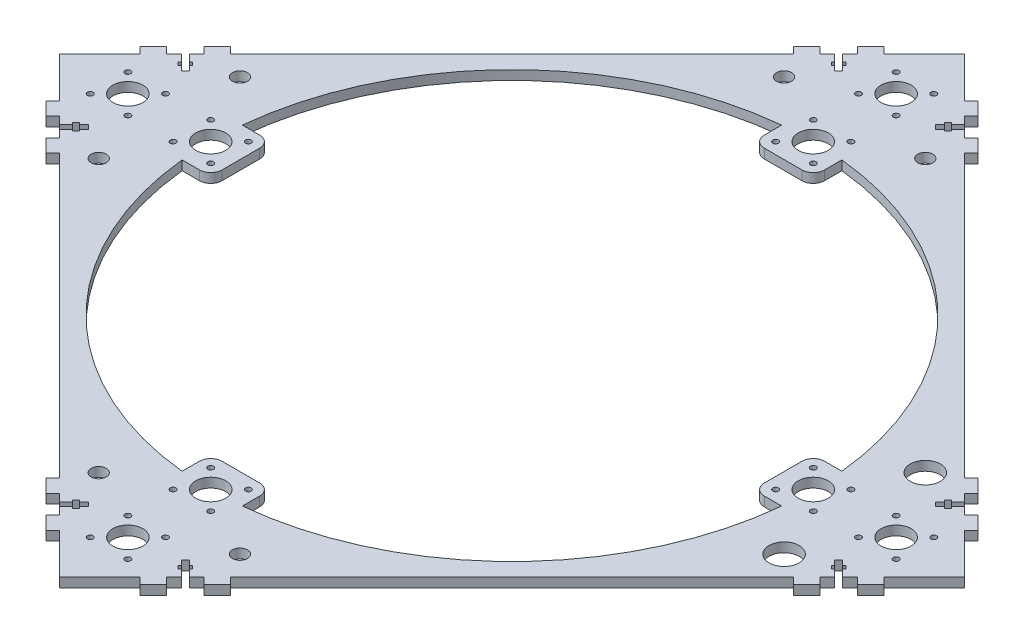
from build123d import *

# Parameters (mm, degrees)
SKETCH1_TOP_SKETCH_7_R   = 8
SKETCH1_TOP_SKETCH_7_R_2 = 1.5
SKETCH1_TOP_SKETCH_7_R_3 = 4
BOSS_EXTRUDE2_DEPTH      = 5


with BuildPart() as part:
    # Sketch1-Top Sketch<7> → Boss-Extrude2 (new body)
    with BuildSketch(Plane(origin=(0, 0, 0), x_dir=(1, 0, 0), z_dir=(0, 1, 0))):
        Polygon((32.022907321, 215.464466094), (24.951839509, 222.535533906), (21.416305603, 219), (0, 240.416305603), (-21.416305603, 219), (-24.951839509, 222.535533906), (-32.022907321, 215.464466094), (-28.487373415, 211.928932188), (-32.39749263, 208.018812973), (-28.861958724, 204.483279068), (-27.978075248, 205.367162544), (-26.210308295, 203.599395591), (-27.094191771, 202.715512115), (-24.619318037, 200.24063838), (-26.74063838, 198.119318037), (-29.215512115, 200.594191771), (-30.099395591, 199.710308295), (-31.867162544, 201.478075248), (-30.983279068, 202.361958724), (-34.518812973, 205.89749263), (-38.428932188, 201.987373415), (-41.964466094, 205.522907321), (-49.035533906, 198.451839509), (-45.5, 194.916305603), (-194.916305603, 45.5), (-198.451839509, 49.035533906), (-205.522907321, 41.964466094), (-201.987373415, 38.428932188), (-205.89749263, 34.518812973), (-202.361958724, 30.983279068), (-201.478075248, 31.867162544), (-199.710308295, 30.099395591), (-200.594191771, 29.215512115), (-198.119318037, 26.74063838), (-200.24063838, 24.619318037), (-202.715512115, 27.094191771), (-203.599395591, 26.210308295), (-205.367162544, 27.978075248), (-204.483279068, 28.861958724), (-208.018812973, 32.39749263), (-211.928932188, 28.487373415), (-215.464466094, 32.022907321), (-222.535533906, 24.951839509), (-219, 21.416305603), (-240.416305603, 0), (-219, -21.416305603), (-222.535533906, -24.951839509), (-215.464466094, -32.022907321), (-211.928932188, -28.487373415), (-208.018812973, -32.39749263), (-204.483279068, -28.861958724), (-205.367162544, -27.978075248), (-203.599395591, -26.210308295), (-202.715512115, -27.094191771), (-200.24063838, -24.619318037), (-198.119318037, -26.74063838), (-200.594191771, -29.215512115), (-199.710308295, -30.099395591), (-201.478075248, -31.867162544), (-202.361958724, -30.983279068), (-205.89749263, -34.518812973), (-201.987373415, -38.428932188), (-205.522907321, -41.964466094), (-198.451839509, -49.035533906), (-194.916305603, -45.5), (-45.5, -194.916305603), (-49.035533906, -198.451839509), (-41.964466094, -205.522907321), (-38.428932188, -201.987373415), (-34.518812973, -205.89749263), (-30.983279068, -202.361958724), (-31.867162544, -201.478075248), (-30.099395591, -199.710308295), (-29.215512115, -200.594191771), (-26.74063838, -198.119318037), (-24.619318037, -200.24063838), (-27.094191771, -202.715512115), (-26.210308295, -203.599395591), (-27.978075248, -205.367162544), (-28.861958724, -204.483279068), (-32.39749263, -208.018812973), (-28.487373415, -211.928932188), (-32.022907321, -215.464466094), (-24.951839509, -222.535533906), (-21.416305603, -219), (0, -240.416305603), (21.416305603, -219), (24.951839509, -222.535533906), (32.022907321, -215.464466094), (28.487373415, -211.928932188), (32.39749263, -208.018812973), (28.861958724, -204.483279068), (27.978075248, -205.367162544), (26.210308295, -203.599395591), (27.094191771, -202.715512115), (24.619318037, -200.24063838), (26.74063838, -198.119318037), (29.215512115, -200.594191771), (30.099395591, -199.710308295), (31.867162544, -201.478075248), (30.983279068, -202.361958724), (34.518812973, -205.89749263), (38.428932188, -201.987373415), (41.964466094, -205.522907321), (49.035533906, -198.451839509), (45.5, -194.916305603), (194.916305603, -45.5), (198.451839509, -49.035533906), (205.522907321, -41.964466094), (201.987373415, -38.428932188), (205.89749263, -34.518812973), (202.361958724, -30.983279068), (201.478075248, -31.867162544), (199.710308295, -30.099395591), (200.594191771, -29.215512115), (198.119318037, -26.74063838), (200.24063838, -24.619318037), (202.715512115, -27.094191771), (203.599395591, -26.210308295), (205.367162544, -27.978075248), (204.483279068, -28.861958724), (208.018812973, -32.39749263), (211.928932188, -28.487373415), (215.464466094, -32.022907321), (222.535533906, -24.951839509), (219, -21.416305603), (240.416305603, 0), (219, 21.416305603), (222.535533906, 24.951839509), (215.464466094, 32.022907321), (211.928932188, 28.487373415), (208.018812973, 32.39749263), (204.483279068, 28.861958724), (205.367162544, 27.978075248), (203.599395591, 26.210308295), (202.715512115, 27.094191771), (200.24063838, 24.619318037), (198.119318037, 26.74063838), (200.594191771, 29.215512115), (199.710308295, 30.099395591), (201.478075248, 31.867162544), (202.361958724, 30.983279068), (205.89749263, 34.518812973), (201.987373415, 38.428932188), (205.522907321, 41.964466094), (198.451839509, 49.035533906), (194.916305603, 45.5), (45.5, 194.916305603), (49.035533906, 198.451839509), (41.964466094, 205.522907321), (38.428932188, 201.987373415), (34.518812973, 205.89749263), (30.983279068, 202.361958724), (31.867162544, 201.478075248), (30.099395591, 199.710308295), (29.215512115, 200.594191771), (26.74063838, 198.119318037), (24.619318037, 200.24063838), (27.094191771, 202.715512115), (26.210308295, 203.599395591), (27.978075248, 205.367162544), (28.861958724, 204.483279068), (32.39749263, 208.018812973), (28.487373415, 211.928932188), align=None)
        with Locations(Location((182, -37.5, 0), (0, 0, 270))):
            Circle(SKETCH1_TOP_SKETCH_7_R, mode=Mode.SUBTRACT)
        with BuildLine():
            Line((16, -159.197989937), (16, -150))
            ThreePointArc((16, -150), (14.242640687, -145.757359313), (10, -144))
            Line((10, -144), (-10, -144))
            ThreePointArc((-10, -144), (-14.242640687, -145.757359313), (-16, -150))
            Line((-16, -150), (-16, -159.197989937))
            ThreePointArc((-16, -159.197989937), (-113.13708499, -113.13708499), (-159.197989937, -16))
            Line((-159.197989937, -16), (-150, -16))
            ThreePointArc((-150, -16), (-145.757359313, -14.242640687), (-144, -10))
            Line((-144, -10), (-144, 10))
            ThreePointArc((-144, 10), (-145.757359313, 14.242640687), (-150, 16))
            Line((-150, 16), (-159.197989937, 16))
            ThreePointArc((-159.197989937, 16), (-113.13708499, 113.13708499), (-16, 159.197989937))
            Line((-16, 159.197989937), (-16, 150))
            ThreePointArc((-16, 150), (-14.242640687, 145.757359313), (-10, 144))
            Line((-10, 144), (10, 144))
            ThreePointArc((10, 144), (14.242640687, 145.757359313), (16, 150))
            Line((16, 150), (16, 159.197989937))
            ThreePointArc((16, 159.197989937), (113.13708499, 113.13708499), (159.197989937, 16))
            Line((159.197989937, 16), (150, 16))
            ThreePointArc((150, 16), (145.757359313, 14.242640687), (144, 10))
            Line((144, 10), (144, -10))
            ThreePointArc((144, -10), (145.757359313, -14.242640687), (150, -16))
            Line((150, -16), (159.197989937, -16))
            ThreePointArc((159.197989937, -16), (113.13708499, -113.13708499), (16, -159.197989937))
        make_face(mode=Mode.SUBTRACT)
        with Locations(Location((160, 0, 0), (0, 0, 270))):
            Circle(SKETCH1_TOP_SKETCH_7_R, mode=Mode.SUBTRACT)
        with Locations(Location((182, 37.5, 0), (0, 0, 270))):
            Circle(SKETCH1_TOP_SKETCH_7_R, mode=Mode.SUBTRACT)
        with Locations(Location((10, 214, 0), (0, 0, 270))):
            Circle(SKETCH1_TOP_SKETCH_7_R_2, mode=Mode.SUBTRACT)
        with Locations(Location((-10, -214, 0), (0, 0, 270))):
            Circle(SKETCH1_TOP_SKETCH_7_R_2, mode=Mode.SUBTRACT)
        with Locations(Location((-10, -194, 0), (0, 0, 270))):
            Circle(SKETCH1_TOP_SKETCH_7_R_2, mode=Mode.SUBTRACT)
        with Locations(Location((-10, -170, 0), (0, 0, 270))):
            Circle(SKETCH1_TOP_SKETCH_7_R_2, mode=Mode.SUBTRACT)
        with Locations(Location((0, -160, 0), (0, 0, 270))):
            Circle(SKETCH1_TOP_SKETCH_7_R, mode=Mode.SUBTRACT)
        with Locations(Location((-10, -150, 0), (0, 0, 270))):
            Circle(SKETCH1_TOP_SKETCH_7_R_2, mode=Mode.SUBTRACT)
        with Locations(Location((-214, -10, 0), (0, 0, 270))):
            Circle(SKETCH1_TOP_SKETCH_7_R_2, mode=Mode.SUBTRACT)
        with Locations(Location((-194, -10, 0), (0, 0, 270))):
            Circle(SKETCH1_TOP_SKETCH_7_R_2, mode=Mode.SUBTRACT)
        with Locations(Location((-170, -10, 0), (0, 0, 270))):
            Circle(SKETCH1_TOP_SKETCH_7_R_2, mode=Mode.SUBTRACT)
        with Locations(Location((-150, -10, 0), (0, 0, 270))):
            Circle(SKETCH1_TOP_SKETCH_7_R_2, mode=Mode.SUBTRACT)
        with Locations(Location((10, -214, 0), (0, 0, 270))):
            Circle(SKETCH1_TOP_SKETCH_7_R_2, mode=Mode.SUBTRACT)
        with Locations(Location((0, -204, 0), (0, 0, 270))):
            Circle(SKETCH1_TOP_SKETCH_7_R, mode=Mode.SUBTRACT)
        with Locations(Location((10, -194, 0), (0, 0, 270))):
            Circle(SKETCH1_TOP_SKETCH_7_R_2, mode=Mode.SUBTRACT)
        with Locations(Location((10, -170, 0), (0, 0, 270))):
            Circle(SKETCH1_TOP_SKETCH_7_R_2, mode=Mode.SUBTRACT)
        with Locations(Location((10, -150, 0), (0, 0, 270))):
            Circle(SKETCH1_TOP_SKETCH_7_R_2, mode=Mode.SUBTRACT)
        with Locations(Location((-204, 0, 0), (0, 0, 270))):
            Circle(SKETCH1_TOP_SKETCH_7_R, mode=Mode.SUBTRACT)
        with Locations(Location((-214, 10, 0), (0, 0, 270))):
            Circle(SKETCH1_TOP_SKETCH_7_R_2, mode=Mode.SUBTRACT)
        with Locations(Location((-194, 10, 0), (0, 0, 270))):
            Circle(SKETCH1_TOP_SKETCH_7_R_2, mode=Mode.SUBTRACT)
        with Locations(Location((-160, 0, 0), (0, 0, 270))):
            Circle(SKETCH1_TOP_SKETCH_7_R, mode=Mode.SUBTRACT)
        with Locations(Location((-170, 10, 0), (0, 0, 270))):
            Circle(SKETCH1_TOP_SKETCH_7_R_2, mode=Mode.SUBTRACT)
        with Locations(Location((-150, 10, 0), (0, 0, 270))):
            Circle(SKETCH1_TOP_SKETCH_7_R_2, mode=Mode.SUBTRACT)
        with Locations(Location((-10, 150, 0), (0, 0, 270))):
            Circle(SKETCH1_TOP_SKETCH_7_R_2, mode=Mode.SUBTRACT)
        with Locations(Location((-10, 170, 0), (0, 0, 270))):
            Circle(SKETCH1_TOP_SKETCH_7_R_2, mode=Mode.SUBTRACT)
        with Locations(Location((-10, 194, 0), (0, 0, 270))):
            Circle(SKETCH1_TOP_SKETCH_7_R_2, mode=Mode.SUBTRACT)
        with Locations(Location((-10, 214, 0), (0, 0, 270))):
            Circle(SKETCH1_TOP_SKETCH_7_R_2, mode=Mode.SUBTRACT)
        with Locations(Location((10, 150, 0), (0, 0, 270))):
            Circle(SKETCH1_TOP_SKETCH_7_R_2, mode=Mode.SUBTRACT)
        with Locations(Location((0, 160, 0), (0, 0, 270))):
            Circle(SKETCH1_TOP_SKETCH_7_R, mode=Mode.SUBTRACT)
        with Locations(Location((10, 170, 0), (0, 0, 270))):
            Circle(SKETCH1_TOP_SKETCH_7_R_2, mode=Mode.SUBTRACT)
        with Locations(Location((10, 194, 0), (0, 0, 270))):
            Circle(SKETCH1_TOP_SKETCH_7_R_2, mode=Mode.SUBTRACT)
        with Locations(Location((0, 204, 0), (0, 0, 270))):
            Circle(SKETCH1_TOP_SKETCH_7_R, mode=Mode.SUBTRACT)
        with Locations(Location((214, 10, 0), (0, 0, 270))):
            Circle(SKETCH1_TOP_SKETCH_7_R_2, mode=Mode.SUBTRACT)
        with Locations(Location((194, 10, 0), (0, 0, 270))):
            Circle(SKETCH1_TOP_SKETCH_7_R_2, mode=Mode.SUBTRACT)
        with Locations(Location((214, -10, 0), (0, 0, 270))):
            Circle(SKETCH1_TOP_SKETCH_7_R_2, mode=Mode.SUBTRACT)
        with Locations(Location((194, -10, 0), (0, 0, 270))):
            Circle(SKETCH1_TOP_SKETCH_7_R_2, mode=Mode.SUBTRACT)
        with Locations(Location((170, 10, 0), (0, 0, 270))):
            Circle(SKETCH1_TOP_SKETCH_7_R_2, mode=Mode.SUBTRACT)
        with Locations(Location((170, -10, 0), (0, 0, 270))):
            Circle(SKETCH1_TOP_SKETCH_7_R_2, mode=Mode.SUBTRACT)
        with Locations(Location((150, 10, 0), (0, 0, 270))):
            Circle(SKETCH1_TOP_SKETCH_7_R_2, mode=Mode.SUBTRACT)
        with Locations(Location((150, -10, 0), (0, 0, 270))):
            Circle(SKETCH1_TOP_SKETCH_7_R_2, mode=Mode.SUBTRACT)
        with Locations(Location((204, 0, 0), (0, 0, 270))):
            Circle(SKETCH1_TOP_SKETCH_7_R, mode=Mode.SUBTRACT)
        with Locations(Location((37.5, 182, 0), (0, 0, 270))):
            Circle(SKETCH1_TOP_SKETCH_7_R_3, mode=Mode.SUBTRACT)
        with Locations(Location((-37.5, 182, 0), (0, 0, 270))):
            Circle(SKETCH1_TOP_SKETCH_7_R_3, mode=Mode.SUBTRACT)
        with Locations(Location((-182, 37.5, 0), (0, 0, 270))):
            Circle(SKETCH1_TOP_SKETCH_7_R_3, mode=Mode.SUBTRACT)
        with Locations(Location((-182, -37.5, 0), (0, 0, 270))):
            Circle(SKETCH1_TOP_SKETCH_7_R_3, mode=Mode.SUBTRACT)
        with Locations(Location((37.5, -182, 0), (0, 0, 270))):
            Circle(SKETCH1_TOP_SKETCH_7_R_3, mode=Mode.SUBTRACT)
        with Locations(Location((-37.5, -182, 0), (0, 0, 270))):
            Circle(SKETCH1_TOP_SKETCH_7_R_3, mode=Mode.SUBTRACT)
    extrude(amount=BOSS_EXTRUDE2_DEPTH)


solid = part.part
